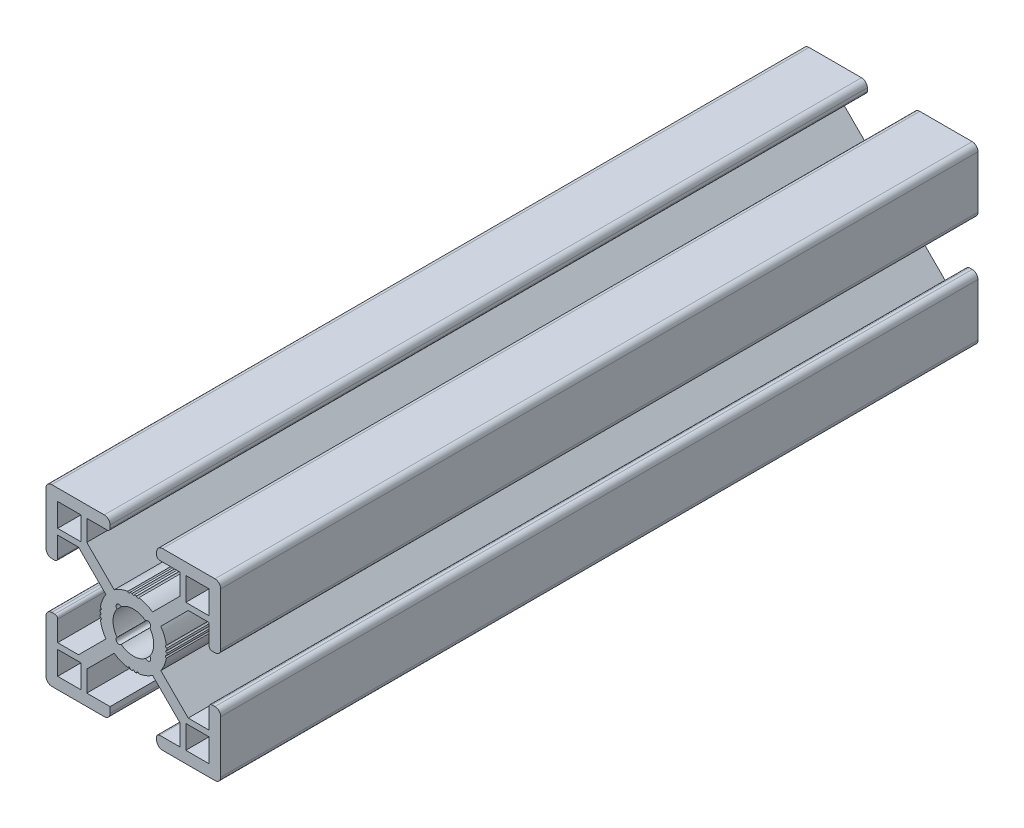
from build123d import *

# Parameters (mm, degrees)
SKETCH1_W           = 4
SKETCH1_H           = 4
BOSS_EXTRUDE1_DEPTH = 65


with BuildPart() as part:
    # Sketch1 → Boss-Extrude1 (new, symmetric)
    with BuildSketch(Plane.XY):
        with BuildLine():
            Line((-15, 14), (-15, 5))
            ThreePointArc((-15, 5), (-14.707106781, 4.292893219), (-14, 4))
            Line((-14, 4), (-13.5, 4))
            ThreePointArc((-13.5, 4), (-13.146446609, 4.146446609), (-13, 4.5))
            Line((-13, 4.5), (-13, 8))
            Line((-13, 8), (-9.414213562, 8))
            Line((-9.414213562, 8), (-4.711011126, 3.296797563))
            ThreePointArc((-4.711011126, 3.296797563), (-5.322383956, 2.17594325), (-5.671345569, 0.947807702))
            ThreePointArc((-5.671345569, 0.947807702), (-5.502585747, 0.723913043), (-5.723511591, 0.551284925))
            ThreePointArc((-5.723511591, 0.551284925), (-5.737706139, 0.375803491), (-5.746521739, 0.199969752))
            ThreePointArc((-5.746521739, 0.199969752), (-5.607354194, 0.140186212), (-5.55, 0))
            ThreePointArc((-5.55, 0), (-5.607354194, -0.140186212), (-5.746521739, -0.199969752))
            ThreePointArc((-5.746521739, -0.199969752), (-5.737706139, -0.375803491), (-5.723511591, -0.551284925))
            ThreePointArc((-5.723511591, -0.551284925), (-5.502585747, -0.723913043), (-5.671345569, -0.947807702))
            ThreePointArc((-5.671345569, -0.947807702), (-5.322383956, -2.17594325), (-4.711011126, -3.296797563))
            Line((-4.711011126, -3.296797563), (-9.414213562, -8))
            Line((-9.414213562, -8), (-13, -8))
            Line((-13, -8), (-13, -4.5))
            ThreePointArc((-13, -4.5), (-13.146446609, -4.146446609), (-13.5, -4))
            Line((-13.5, -4), (-14, -4))
            ThreePointArc((-14, -4), (-14.707106781, -4.292893219), (-15, -5))
            Line((-15, -5), (-15, -14))
            ThreePointArc((-15, -14), (-14.707106781, -14.707106781), (-14, -15))
            Line((-14, -15), (-5, -15))
            ThreePointArc((-5, -15), (-4.292893219, -14.707106781), (-4, -14))
            Line((-4, -14), (-4, -13))
            Line((-4, -13), (-8, -13))
            Line((-8, -13), (-8, -9.414213562))
            Line((-8, -9.414213562), (-3.296797563, -4.711011126))
            ThreePointArc((-3.296797563, -4.711011126), (-2.17594325, -5.322383956), (-0.947807702, -5.671345569))
            ThreePointArc((-0.947807702, -5.671345569), (-0.723913043, -5.502585747), (-0.551284925, -5.723511591))
            ThreePointArc((-0.551284925, -5.723511591), (-0.375803491, -5.737706139), (-0.199969752, -5.746521739))
            ThreePointArc((-0.199969752, -5.746521739), (-0.140186212, -5.607354194), (0, -5.55))
            ThreePointArc((0, -5.55), (0.140186212, -5.607354194), (0.199969752, -5.746521739))
            ThreePointArc((0.199969752, -5.746521739), (0.375803491, -5.737706139), (0.551284925, -5.723511591))
            ThreePointArc((0.551284925, -5.723511591), (0.723913043, -5.502585747), (0.947807702, -5.671345569))
            ThreePointArc((0.947807702, -5.671345569), (2.17594325, -5.322383956), (3.296797563, -4.711011126))
            Line((3.296797563, -4.711011126), (8, -9.414213562))
            Line((8, -9.414213562), (8, -13))
            Line((8, -13), (4.5, -13))
            ThreePointArc((4.5, -13), (4.146446609, -13.146446609), (4, -13.5))
            Line((4, -13.5), (4, -14))
            ThreePointArc((4, -14), (4.292893219, -14.707106781), (5, -15))
            Line((5, -15), (14, -15))
            ThreePointArc((14, -15), (14.707106781, -14.707106781), (15, -14))
            Line((15, -14), (15, -5))
            ThreePointArc((15, -5), (14.707106781, -4.292893219), (14, -4))
            Line((14, -4), (13.5, -4))
            ThreePointArc((13.5, -4), (13.146446609, -4.146446609), (13, -4.5))
            Line((13, -4.5), (13, -8))
            Line((13, -8), (9.414213562, -8))
            Line((9.414213562, -8), (4.711011126, -3.296797563))
            ThreePointArc((4.711011126, -3.296797563), (5.322383956, -2.17594325), (5.671345569, -0.947807702))
            ThreePointArc((5.671345569, -0.947807702), (5.502585747, -0.723913043), (5.723511591, -0.551284925))
            ThreePointArc((5.723511591, -0.551284925), (5.737706139, -0.375803491), (5.746521739, -0.199969752))
            ThreePointArc((5.746521739, -0.199969752), (5.607354194, -0.140186212), (5.55, 0))
            ThreePointArc((5.55, 0), (5.607354194, 0.140186212), (5.746521739, 0.199969752))
            ThreePointArc((5.746521739, 0.199969752), (5.737706139, 0.375803491), (5.723511591, 0.551284925))
            ThreePointArc((5.723511591, 0.551284925), (5.502585747, 0.723913043), (5.671345569, 0.947807702))
            ThreePointArc((5.671345569, 0.947807702), (5.322383956, 2.17594325), (4.711011126, 3.296797563))
            Line((4.711011126, 3.296797563), (9.414213562, 8))
            Line((9.414213562, 8), (13, 8))
            Line((13, 8), (13, 4.5))
            ThreePointArc((13, 4.5), (13.146446609, 4.146446609), (13.5, 4))
            Line((13.5, 4), (14, 4))
            ThreePointArc((14, 4), (14.707106781, 4.292893219), (15, 5))
            Line((15, 5), (15, 14))
            ThreePointArc((15, 14), (14.707106781, 14.707106781), (14, 15))
            Line((14, 15), (5, 15))
            ThreePointArc((5, 15), (4.292893219, 14.707106781), (4, 14))
            Line((4, 14), (4, 13.5))
            ThreePointArc((4, 13.5), (4.146446609, 13.146446609), (4.5, 13))
            Line((4.5, 13), (8, 13))
            Line((8, 13), (8, 9.414213562))
            Line((8, 9.414213562), (3.296797563, 4.711011126))
            ThreePointArc((3.296797563, 4.711011126), (2.17594325, 5.322383956), (0.947807702, 5.671345569))
            ThreePointArc((0.947807702, 5.671345569), (0.723913043, 5.502585747), (0.551284925, 5.723511591))
            ThreePointArc((0.551284925, 5.723511591), (0.375803491, 5.737706139), (0.199969752, 5.746521739))
            ThreePointArc((0.199969752, 5.746521739), (0.140186212, 5.607354194), (0, 5.55))
            ThreePointArc((0, 5.55), (-0.140186212, 5.607354194), (-0.199969752, 5.746521739))
            ThreePointArc((-0.199969752, 5.746521739), (-0.375803491, 5.737706139), (-0.551284925, 5.723511591))
            ThreePointArc((-0.551284925, 5.723511591), (-0.723913043, 5.502585747), (-0.947807702, 5.671345569))
            ThreePointArc((-0.947807702, 5.671345569), (-2.17594325, 5.322383956), (-3.296797563, 4.711011126))
            Line((-3.296797563, 4.711011126), (-8, 9.414213562))
            Line((-8, 9.414213562), (-8, 13))
            Line((-8, 13), (-4.5, 13))
            ThreePointArc((-4.5, 13), (-4.146446609, 13.146446609), (-4, 13.5))
            Line((-4, 13.5), (-4, 14))
            ThreePointArc((-4, 14), (-4.292893219, 14.707106781), (-5, 15))
            Line((-5, 15), (-14, 15))
            ThreePointArc((-14, 15), (-14.707106781, 14.707106781), (-15, 14))
        make_face()
        with Locations((-11, -11)):
            Rectangle(SKETCH1_W, SKETCH1_H, mode=Mode.SUBTRACT)
        with Locations((11, -11)):
            Rectangle(SKETCH1_W, SKETCH1_H, mode=Mode.SUBTRACT)
        with BuildLine():
            ThreePointArc((-2.096969605, 2.802270236), (-1.105000944, 3.320989749), (0, 3.5))
            ThreePointArc((0, 3.5), (1.105000944, 3.320989749), (2.096969605, 2.802270236))
            ThreePointArc((2.096969605, 2.802270236), (2.828427125, 2.828427125), (2.802270236, 2.096969605))
            ThreePointArc((2.802270236, 2.096969605), (3.320989749, 1.105000944), (3.5, 0))
            ThreePointArc((3.5, 0), (3.320989749, -1.105000944), (2.802270236, -2.096969605))
            ThreePointArc((2.802270236, -2.096969605), (2.828427125, -2.828427125), (2.096969605, -2.802270236))
            ThreePointArc((2.096969605, -2.802270236), (1.105000944, -3.320989749), (0, -3.5))
            ThreePointArc((0, -3.5), (-1.105000944, -3.320989749), (-2.096969605, -2.802270236))
            ThreePointArc((-2.096969605, -2.802270236), (-2.828427125, -2.828427125), (-2.802270236, -2.096969605))
            ThreePointArc((-2.802270236, -2.096969605), (-3.320989749, -1.105000944), (-3.5, 0))
            ThreePointArc((-3.5, 0), (-3.320989749, 1.105000944), (-2.802270236, 2.096969605))
            ThreePointArc((-2.802270236, 2.096969605), (-2.828427125, 2.828427125), (-2.096969605, 2.802270236))
        make_face(mode=Mode.SUBTRACT)
        with Locations((-11, 11)):
            Rectangle(SKETCH1_W, SKETCH1_H, mode=Mode.SUBTRACT)
        with Locations((11, 11)):
            Rectangle(SKETCH1_W, SKETCH1_H, mode=Mode.SUBTRACT)
    extrude(amount=BOSS_EXTRUDE1_DEPTH, both=True)


solid = part.part
